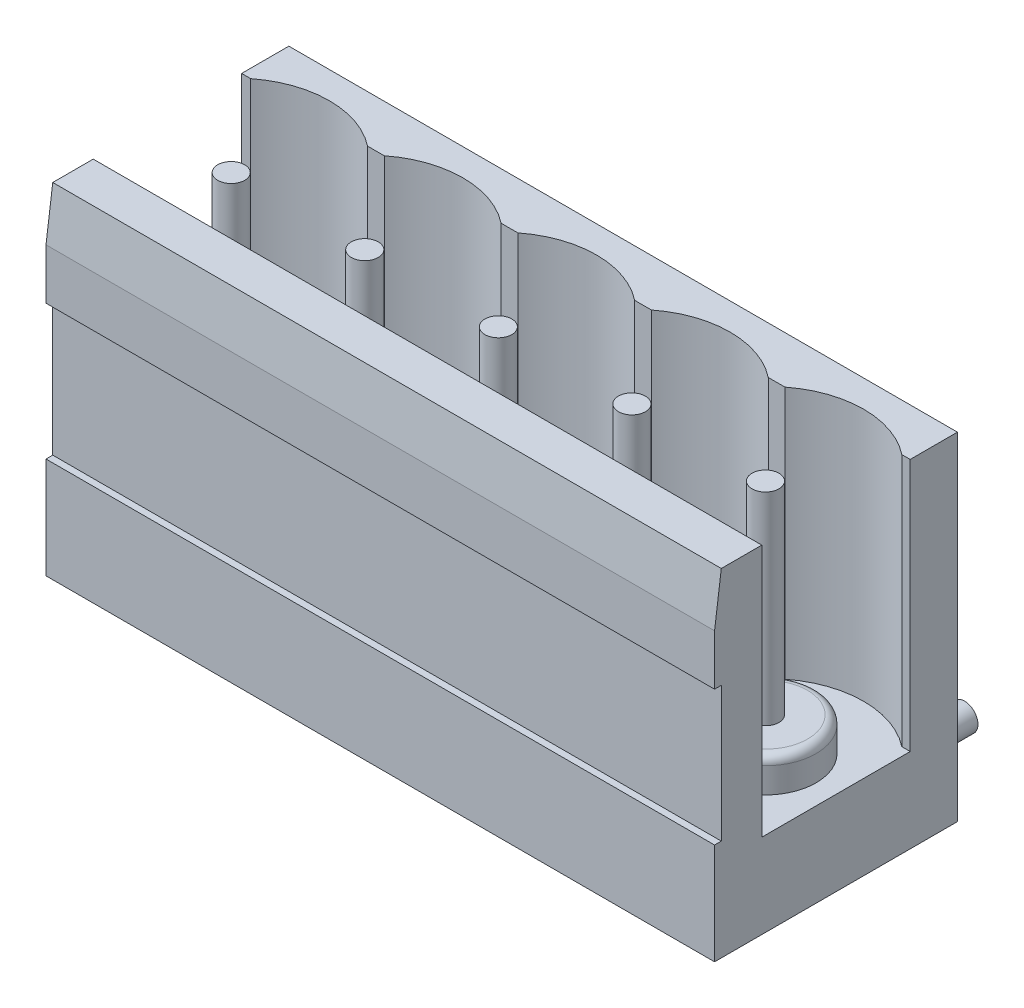
from build123d import *

# Parameters (mm, degrees)
SKETCH_1_W          = 31.5
SKETCH_1_H          = 10
EXTRUDE_1_DEPTH     = 7.2
SKETCH_2_W          = 1.17709233
SKETCH_2_H          = 4
CUT_EXTRUDE_1_DEPTH = 34.824399477
CUT_EXTRUDE_2_DEPTH = 34.824399477
CUT_EXTRUDE_4_DEPTH = 7.5
CUT_EXTRUDE_5_DEPTH = 7.5
SKETCH_8_W          = 1
SKETCH_8_H          = 4.2
CUT_EXTRUDE_6_DEPTH = 1
SKETCH_9_R          = 0.4
EXTRUDE_5_DEPTH     = 6.5
SKETCH_10_R         = 0.4
EXTRUDE_6_DEPTH     = 7
SKETCH_11_R         = 1.5
EXTRUDE_7_DEPTH     = 1
FILLET_1_R          = 0.25
CUT_EXTRUDE_7_DEPTH = 34.824399477


with BuildPart() as part:
    # 草图1 → 凸台-拉伸1 (new body)
    with BuildSketch(Plane.XY):
        with Locations((15.75, 5)):
            Rectangle(SKETCH_1_W, SKETCH_1_H)
    extrude(amount=EXTRUDE_1_DEPTH)

    # 草图2 → 切除-拉伸1 (cut, through all)
    with BuildSketch(Plane(origin=(31.5, 0, 0), x_dir=(0, 0, -1), z_dir=(1, 0, 0))):
        with Locations((-7.588546165, 5)):
            Rectangle(SKETCH_2_W, SKETCH_2_H)
    extrude(amount=-CUT_EXTRUDE_1_DEPTH, mode=Mode.SUBTRACT)

    # 草图3 → 切除-拉伸2 (cut, through all)
    with BuildSketch(Plane(origin=(31.5, 0, 0), x_dir=(0, 0, -1), z_dir=(1, 0, 0))):
        Polygon((-7, 10), (-7.2, 8.5), (-7.2, 10), align=None)
    extrude(amount=-CUT_EXTRUDE_2_DEPTH, mode=Mode.SUBTRACT)

    # 草图6 → 切除-拉伸4 (cut)
    with BuildSketch(Plane(origin=(0, 10, 0), x_dir=(1, 0, 0), z_dir=(0, 1, 0))):
        Polygon((0.5, -1.4), (0.391822444, -1.4), (0, -1.4), (0, -5.8), (0.391822444, -5.8), (0.5, -5.8), (31.5, -5.8), (31.5, -1.4), align=None)
    extrude(amount=-CUT_EXTRUDE_4_DEPTH, mode=Mode.SUBTRACT)

    # 草图7 → 切除-拉伸5 (cut)
    with BuildSketch(Plane(origin=(0, 10, 0), x_dir=(1, 0, 0), z_dir=(0, 1, 0))):
        with BuildLine():
            Line((0.267949192, -1.4), (3.732050808, -1.4))
            ThreePointArc((3.732050808, -1.4), (2, -0.8), (0.267949192, -1.4))
        make_face()
        with BuildLine():
            Line((27.987949192, -1.4), (31.452050808, -1.4))
            ThreePointArc((31.452050808, -1.4), (29.72, -0.8), (27.987949192, -1.4))
        make_face()
        with BuildLine():
            Line((24.027949192, -1.4), (27.492050808, -1.4))
            ThreePointArc((27.492050808, -1.4), (25.76, -0.8), (24.027949192, -1.4))
        make_face()
        with BuildLine():
            Line((20.067949192, -1.4), (23.532050808, -1.4))
            ThreePointArc((23.532050808, -1.4), (21.8, -0.8), (20.067949192, -1.4))
        make_face()
        with BuildLine():
            Line((16.107949192, -1.4), (19.572050808, -1.4))
            ThreePointArc((19.572050808, -1.4), (17.84, -0.8), (16.107949192, -1.4))
        make_face()
        with BuildLine():
            Line((12.147949192, -1.4), (15.612050808, -1.4))
            ThreePointArc((15.612050808, -1.4), (13.88, -0.8), (12.147949192, -1.4))
        make_face()
        with BuildLine():
            Line((8.187949192, -1.4), (11.652050808, -1.4))
            ThreePointArc((11.652050808, -1.4), (9.92, -0.8), (8.187949192, -1.4))
        make_face()
        with BuildLine():
            Line((4.227949192, -1.4), (7.692050808, -1.4))
            ThreePointArc((7.692050808, -1.4), (5.96, -0.8), (4.227949192, -1.4))
        make_face()
    extrude(amount=-CUT_EXTRUDE_5_DEPTH, mode=Mode.SUBTRACT)

    # 草图8 → 切除-拉伸6 (cut)
    with BuildSketch(Plane.XZ):
        with Locations((17.73, 2.1)):
            Rectangle(SKETCH_8_W, SKETCH_8_H)
        with Locations((21.69, 2.1)):
            Rectangle(SKETCH_8_W, SKETCH_8_H)
        with Locations((25.65, 2.1)):
            Rectangle(SKETCH_8_W, SKETCH_8_H)
        with Locations((29.61, 2.1)):
            Rectangle(SKETCH_8_W, SKETCH_8_H)
        with Locations((1.89, 2.1)):
            Rectangle(SKETCH_8_W, SKETCH_8_H)
        with Locations((5.85, 2.1)):
            Rectangle(SKETCH_8_W, SKETCH_8_H)
        with Locations((9.81, 2.1)):
            Rectangle(SKETCH_8_W, SKETCH_8_H)
        with Locations((13.77, 2.1)):
            Rectangle(SKETCH_8_W, SKETCH_8_H)
    extrude(amount=-CUT_EXTRUDE_6_DEPTH, mode=Mode.SUBTRACT)

    # 草图9 → 凸台-拉伸5 (add)
    with BuildSketch(Plane(origin=(0, 0, 4.2), x_dir=(-1, 0, 0), z_dir=(0, 0, -1))):
        with Locations(Location((-1.89, 0.5, 0), (0, 0, 180))):
            Circle(SKETCH_9_R)
        with Locations(Location((-5.85, 0.5, 0), (0, 0, 180))):
            Circle(SKETCH_9_R)
        with Locations(Location((-9.81, 0.5, 0), (0, 0, 180))):
            Circle(SKETCH_9_R)
        with Locations(Location((-13.77, 0.5, 0), (0, 0, 180))):
            Circle(SKETCH_9_R)
        with Locations(Location((-17.73, 0.5, 0), (0, 0, 180))):
            Circle(SKETCH_9_R)
        with Locations(Location((-21.69, 0.5, 0), (0, 0, 180))):
            Circle(SKETCH_9_R)
        with Locations(Location((-25.65, 0.5, 0), (0, 0, 180))):
            Circle(SKETCH_9_R)
        with Locations(Location((-29.61, 0.5, 0), (0, 0, 180))):
            Circle(SKETCH_9_R)
    extrude(amount=EXTRUDE_5_DEPTH)

    # 草图10 → 凸台-拉伸6 (add)
    with BuildSketch(Plane(origin=(0, 2.5, 0), x_dir=(1, 0, 0), z_dir=(0, 1, 0))):
        with Locations(Location((13.77, -3.6, 0), (0, 0, 270))):
            Circle(SKETCH_10_R)
        with Locations(Location((9.81, -3.6, 0), (0, 0, 270))):
            Circle(SKETCH_10_R)
        with Locations(Location((5.85, -3.6, 0), (0, 0, 270))):
            Circle(SKETCH_10_R)
        with Locations(Location((1.89, -3.6, 0), (0, 0, 270))):
            Circle(SKETCH_10_R)
        with Locations(Location((29.61, -3.6, 0), (0, 0, 90))):
            Circle(SKETCH_10_R)
        with Locations(Location((25.65, -3.6, 0), (0, 0, 90))):
            Circle(SKETCH_10_R)
        with Locations(Location((21.69, -3.6, 0), (0, 0, 90))):
            Circle(SKETCH_10_R)
        with Locations(Location((17.73, -3.6, 0), (0, 0, 90))):
            Circle(SKETCH_10_R)
    extrude(amount=EXTRUDE_6_DEPTH)

    # 草图11 → 凸台-拉伸7 (add)
    with BuildSketch(Plane(origin=(0, 2.5, 0), x_dir=(1, 0, 0), z_dir=(0, 1, 0))):
        with Locations(Location((29.61, -3.6, 0), (0, 0, 270))):
            Circle(SKETCH_11_R)
        with Locations(Location((25.65, -3.6, 0), (0, 0, 270))):
            Circle(SKETCH_11_R)
        with Locations(Location((21.69, -3.6, 0), (0, 0, 270))):
            Circle(SKETCH_11_R)
        with Locations(Location((17.73, -3.6, 0), (0, 0, 270))):
            Circle(SKETCH_11_R)
        with Locations(Location((13.77, -3.6, 0), (0, 0, 270))):
            Circle(SKETCH_11_R)
        with Locations(Location((9.81, -3.6, 0), (0, 0, 270))):
            Circle(SKETCH_11_R)
        with Locations(Location((5.85, -3.6, 0), (0, 0, 270))):
            Circle(SKETCH_11_R)
        with Locations(Location((1.89, -3.6, 0), (0, 0, 270))):
            Circle(SKETCH_11_R)
    extrude(amount=EXTRUDE_7_DEPTH)

    # 圆角1
    fillet_1_edges = [part.edges().sort_by_distance(p)[0] for p in [
        (29.61, 3.5, 2.1),
        (25.65, 3.5, 2.1),
        (21.69, 3.5, 2.1),
        (17.73, 3.5, 2.1),
        (13.77, 3.5, 2.1),
        (9.81, 3.5, 2.1),
        (5.85, 3.5, 2.1),
        (1.89, 3.5, 2.1),
    ]]
    fillet(fillet_1_edges, radius=FILLET_1_R)

    # 草图13 → 切除-拉伸7 (cut, through all)
    with BuildSketch(Plane(origin=(0, 10, 0), x_dir=(1, 0, 0), z_dir=(0, 1, 0))):
        Polygon((19.82, 0), (19.82, -8.061700908), (32.018836879, -8.061700908), (32.018836879, 2.753264686), (19.82, 2.753264686), align=None)
    extrude(amount=-CUT_EXTRUDE_7_DEPTH, mode=Mode.SUBTRACT)


solid = part.part
